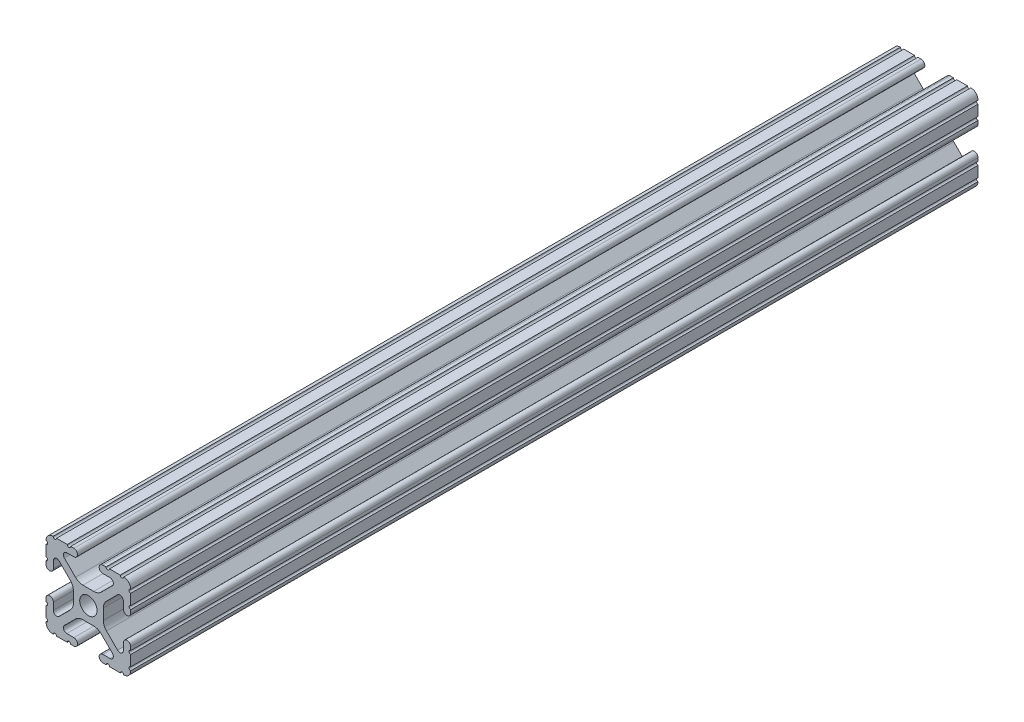
from build123d import *

# Parameters (mm, degrees)
SKETCH1_R           = 2.6035
BOSS_EXTRUDE1_DEPTH = 254


with BuildPart() as part:
    # Sketch1 → Boss-Extrude1 (new body)
    with BuildSketch(Plane(origin=(0, 0, -254), x_dir=(-1, 0, 0), z_dir=(0, 0, -1))):
        with BuildLine():
            Line((12.700000001, -9.550399995), (12.700000001, -6.333083598))
            ThreePointArc((12.700000001, -6.333083598), (12.192000001, -5.825083598), (12.700000001, -5.317083598))
            Line((12.700000001, -5.317083598), (12.700000001, -4.343399998))
            ThreePointArc((12.700000001, -4.343399998), (11.595100001, -3.238499998), (10.490200001, -4.343399998))
            Line((10.490200001, -4.343399998), (10.490200001, -6.474794454))
            ThreePointArc((10.490200001, -6.474794454), (9.863006368, -7.413456059), (8.755779511, -7.193214943))
            Line((8.755779511, -7.193214943), (5.425735971, -3.863171403))
            ThreePointArc((5.425735971, -3.863171403), (4.737482485, -2.83312727), (4.495800001, -1.618107372))
            Line((4.495800001, -1.618107372), (4.495800001, 1.618107372))
            ThreePointArc((4.495800001, 1.618107372), (4.737482485, 2.83312727), (5.425735971, 3.863171403))
            Line((5.425735971, 3.863171403), (8.755779512, 7.193214944))
            ThreePointArc((8.755779512, 7.193214944), (9.863006368, 7.413456059), (10.490200001, 6.474794455))
            Line((10.490200001, 6.474794455), (10.490200001, 4.343399973))
            ThreePointArc((10.490200001, 4.343399973), (11.595100001, 3.238499973), (12.700000001, 4.343399973))
            Line((12.700000001, 4.343399973), (12.700000001, 5.317083602))
            ThreePointArc((12.700000001, 5.317083602), (12.192000001, 5.825083602), (12.700000001, 6.333083602))
            Line((12.700000001, 6.333083602), (12.700000001, 9.550400003))
            ThreePointArc((12.700000001, 9.550400003), (12.192000008, 10.058323495), (12.699846987, 10.566399978))
            ThreePointArc((12.699846987, 10.566399978), (12.082522518, 12.08252252), (10.566399975, 12.699846984))
            ThreePointArc((10.566399975, 12.699846984), (10.058323492, 12.19200001), (9.550400004, 12.700000002))
            Line((9.550400004, 12.700000002), (6.333083601, 12.700000002))
            ThreePointArc((6.333083601, 12.700000002), (5.825083601, 12.192000002), (5.317083601, 12.700000002))
            Line((5.317083601, 12.700000002), (4.343400001, 12.700000002))
            ThreePointArc((4.343400001, 12.700000002), (3.238500001, 11.595100002), (4.343400001, 10.490200002))
            Line((4.343400001, 10.490200002), (6.474794457, 10.490200002))
            ThreePointArc((6.474794457, 10.490200002), (7.413456062, 9.863006369), (7.193214947, 8.755779512))
            Line((7.193214947, 8.755779512), (3.863171407, 5.425735972))
            ThreePointArc((3.863171407, 5.425735972), (2.833127274, 4.737482486), (1.618107376, 4.495800002))
            Line((1.618107376, 4.495800002), (-1.618107374, 4.495800002))
            ThreePointArc((-1.618107374, 4.495800002), (-2.833127271, 4.737482486), (-3.863171404, 5.425735972))
            Line((-3.863171404, 5.425735972), (-7.193214944, 8.755779512))
            ThreePointArc((-7.193214944, 8.755779512), (-7.41345606, 9.863006369), (-6.474794455, 10.490200002))
            Line((-6.474794455, 10.490200002), (-4.34339997, 10.490200002))
            ThreePointArc((-4.34339997, 10.490200002), (-3.23849997, 11.595100002), (-4.34339997, 12.700000002))
            Line((-4.34339997, 12.700000002), (-5.317083599, 12.700000002))
            ThreePointArc((-5.317083599, 12.700000002), (-5.825083599, 12.192000002), (-6.333083599, 12.700000002))
            Line((-6.333083599, 12.700000002), (-9.550399999, 12.700000002))
            ThreePointArc((-9.550399999, 12.700000002), (-10.058323491, 12.192000008), (-10.566399976, 12.699846986))
            ThreePointArc((-10.566399976, 12.699846986), (-12.082522518, 12.082522518), (-12.699846982, 10.566399974))
            ThreePointArc((-12.699846982, 10.566399974), (-12.192000009, 10.058323491), (-12.7, 9.550400003))
            Line((-12.7, 9.550400003), (-12.7, 6.3330836))
            ThreePointArc((-12.7, 6.3330836), (-12.192, 5.8250836), (-12.7, 5.3170836))
            Line((-12.7, 5.3170836), (-12.7, 4.3434))
            ThreePointArc((-12.7, 4.3434), (-11.5951, 3.2385), (-10.4902, 4.3434))
            Line((-10.4902, 4.3434), (-10.4902, 6.474794456))
            ThreePointArc((-10.4902, 6.474794456), (-9.863006367, 7.413456061), (-8.75577951, 7.193214945))
            Line((-8.75577951, 7.193214945), (-5.42573597, 3.863171405))
            ThreePointArc((-5.42573597, 3.863171405), (-4.737482484, 2.833127272), (-4.4958, 1.618107374))
            Line((-4.4958, 1.618107374), (-4.4958, -1.618107374))
            ThreePointArc((-4.4958, -1.618107374), (-4.737482484, -2.833127272), (-5.42573597, -3.863171405))
            Line((-5.42573597, -3.863171405), (-8.75577951, -7.193214945))
            ThreePointArc((-8.75577951, -7.193214945), (-9.863006367, -7.413456061), (-10.4902, -6.474794456))
            Line((-10.4902, -6.474794456), (-10.4902, -4.343399971))
            ThreePointArc((-10.4902, -4.343399971), (-11.5951, -3.238499971), (-12.7, -4.343399971))
            Line((-12.7, -4.343399971), (-12.7, -5.3170836))
            ThreePointArc((-12.7, -5.3170836), (-12.192, -5.8250836), (-12.7, -6.3330836))
            Line((-12.7, -6.3330836), (-12.7, -9.5504))
            ThreePointArc((-12.7, -9.5504), (-12.192000006, -10.058323492), (-12.699846984, -10.566399977))
            ThreePointArc((-12.699846984, -10.566399977), (-12.082522516, -12.082522519), (-10.566399972, -12.699846983))
            ThreePointArc((-10.566399972, -12.699846983), (-10.058323489, -12.192000009), (-9.550400001, -12.700000001))
            Line((-9.550400001, -12.700000001), (-6.333083598, -12.700000001))
            ThreePointArc((-6.333083598, -12.700000001), (-5.825083598, -12.192000001), (-5.317083598, -12.700000001))
            Line((-5.317083598, -12.700000001), (-4.343399998, -12.700000001))
            ThreePointArc((-4.343399998, -12.700000001), (-3.238499998, -11.595100001), (-4.343399998, -10.490200001))
            Line((-4.343399998, -10.490200001), (-6.474794454, -10.490200001))
            ThreePointArc((-6.474794454, -10.490200001), (-7.413456059, -9.863006368), (-7.193214943, -8.755779511))
            Line((-7.193214943, -8.755779511), (-3.863171403, -5.425735971))
            ThreePointArc((-3.863171403, -5.425735971), (-2.83312727, -4.737482485), (-1.618107372, -4.495800001))
            Line((-1.618107372, -4.495800001), (1.618107375, -4.495800001))
            ThreePointArc((1.618107375, -4.495800001), (2.833127273, -4.737482485), (3.863171406, -5.425735971))
            Line((3.863171406, -5.425735971), (7.193214946, -8.755779512))
            ThreePointArc((7.193214946, -8.755779512), (7.413456062, -9.863006368), (6.474794457, -10.490200001))
            Line((6.474794457, -10.490200001), (4.343399973, -10.490200001))
            ThreePointArc((4.343399973, -10.490200001), (3.238499973, -11.595100001), (4.343399973, -12.700000001))
            Line((4.343399973, -12.700000001), (5.317083602, -12.700000001))
            ThreePointArc((5.317083602, -12.700000001), (5.825083602, -12.192000001), (6.333083602, -12.700000001))
            Line((6.333083602, -12.700000001), (9.550400002, -12.700000001))
            ThreePointArc((9.550400002, -12.700000001), (10.058323494, -12.192000007), (10.566399979, -12.699846985))
            ThreePointArc((10.566399979, -12.699846985), (12.082522519, -12.082522518), (12.699846986, -10.566399978))
            ThreePointArc((12.699846986, -10.566399978), (12.192000004, -10.058323491), (12.700000001, -9.550399995))
        make_face()
        with Locations(Location((0, 0, 0), (0, 0, 180))):
            Circle(SKETCH1_R, mode=Mode.SUBTRACT)
    extrude(amount=-BOSS_EXTRUDE1_DEPTH)


solid = part.part
